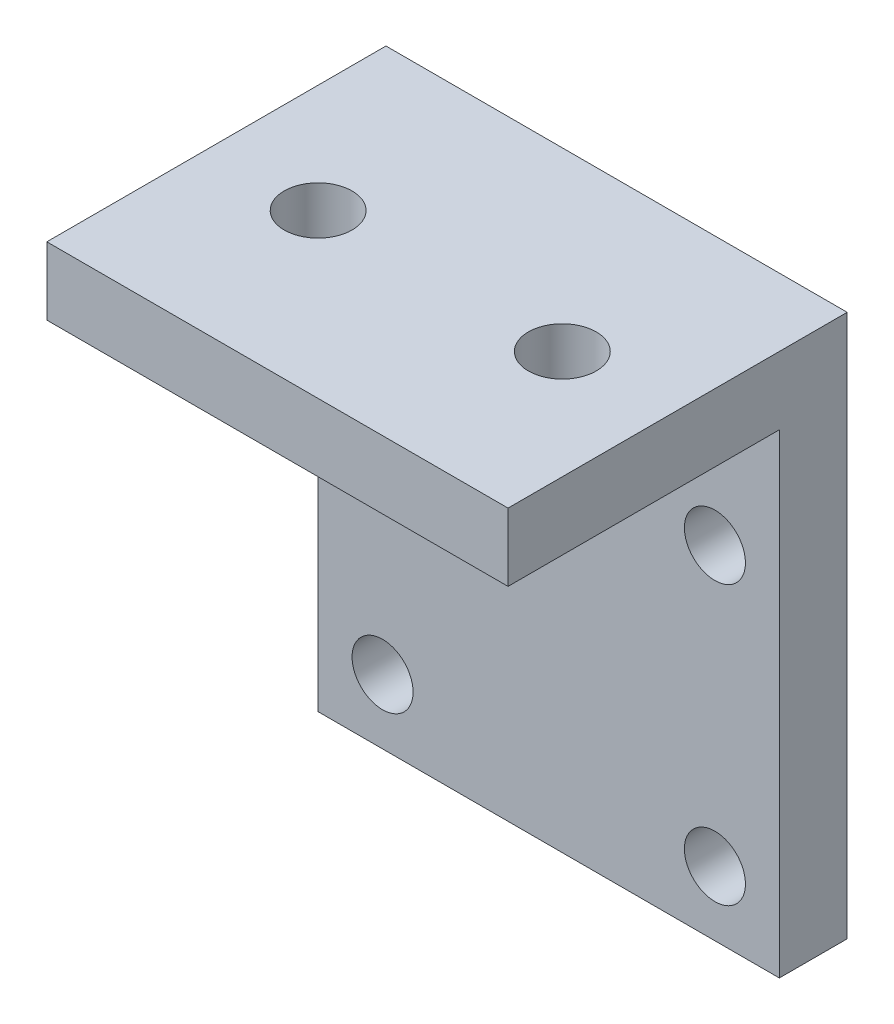
from build123d import *

# Parameters (mm, degrees)
SKETCH1_W           = 34
SKETCH1_H           = 30
SKETCH1_R           = 2.25
BOSS_EXTRUDE1_DEPTH = 5
SKETCH2_W           = 34
SKETCH2_H           = 5
BOSS_EXTRUDE2_DEPTH = 10
SKETCH3_W           = 34
SKETCH3_H           = 5
BOSS_EXTRUDE3_DEPTH = 20
SKETCH4_R           = 2.5
CUT_EXTRUDE1_DEPTH  = 20


with BuildPart() as part:
    # Sketch1 → Boss-Extrude1 (new body)
    with BuildSketch(Plane.XY):
        with Locations((17, 15)):
            Rectangle(SKETCH1_W, SKETCH1_H)
        with Locations((4.75, 25.25)):
            Circle(SKETCH1_R, mode=Mode.SUBTRACT)
        with Locations((29.25, 25.25)):
            Circle(SKETCH1_R, mode=Mode.SUBTRACT)
        with Locations((29.25, 4.75)):
            Circle(SKETCH1_R, mode=Mode.SUBTRACT)
        with Locations((4.75, 4.75)):
            Circle(SKETCH1_R, mode=Mode.SUBTRACT)
    extrude(amount=BOSS_EXTRUDE1_DEPTH)

    # Sketch2 → Boss-Extrude2 (add)
    with BuildSketch(Plane(origin=(0, 30, 0), x_dir=(1, 0, 0), z_dir=(0, 1, 0))):
        with Locations((17, -2.5)):
            Rectangle(SKETCH2_W, SKETCH2_H)
    extrude(amount=BOSS_EXTRUDE2_DEPTH)

    # Sketch3 → Boss-Extrude3 (add)
    with BuildSketch(Plane.XY.offset(5)):
        with Locations((17, 37.5)):
            Rectangle(SKETCH3_W, SKETCH3_H)
    extrude(amount=BOSS_EXTRUDE3_DEPTH)

    # Sketch4 → Cut-Extrude1 (cut)
    with BuildSketch(Plane(origin=(0, 40, 0), x_dir=(1, 0, 0), z_dir=(0, 1, 0))):
        with Locations(Location((8, -13, 0), (0, 0, 270))):
            Circle(SKETCH4_R)
        with Locations(Location((26, -13, 0), (0, 0, 270))):
            Circle(SKETCH4_R)
    extrude(amount=-CUT_EXTRUDE1_DEPTH, mode=Mode.SUBTRACT)


solid = part.part
